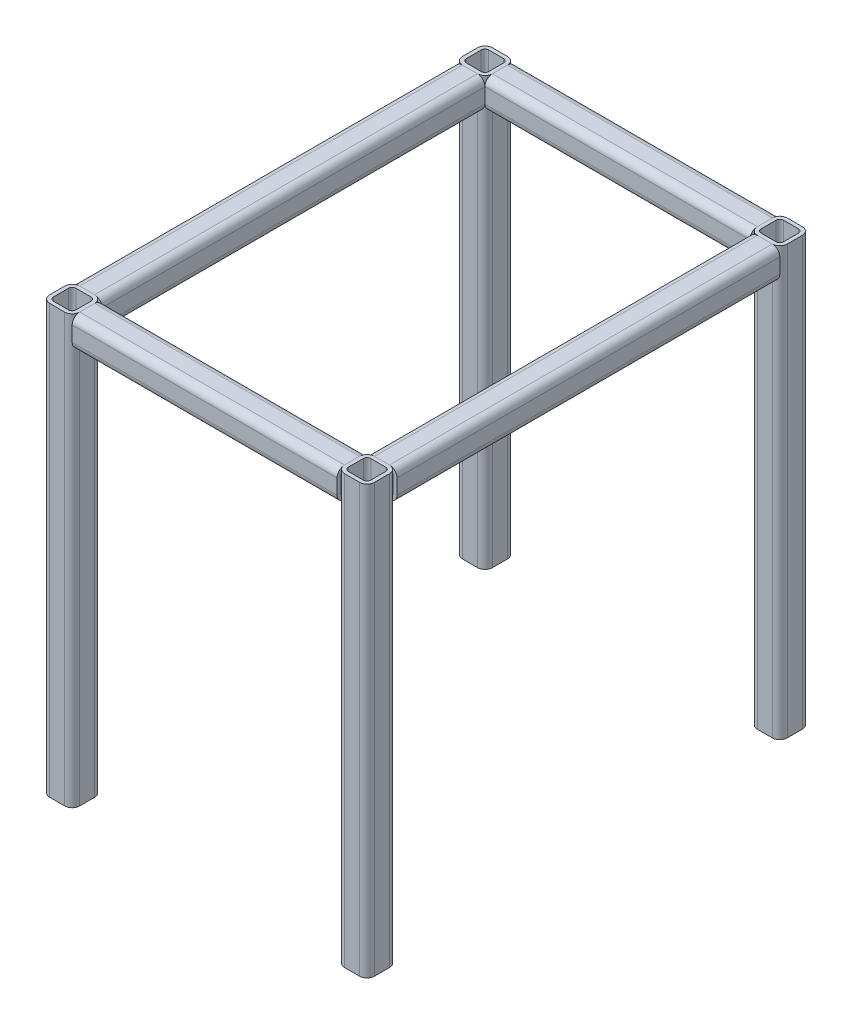
from build123d import *

# Parameters (mm, degrees)
SQUARE_TUBE_2_X_2_X_0_25_1_DEPTH      = 700
SQUARE_TUBE_2_X_2_X_0_25_1_DEPTH_BACK = 25.4
SQUARE_TUBE_2_X_2_X_0_25_1_2_DEPTH    = 725.4
SQUARE_TUBE_2_X_2_X_0_25_1_3_DEPTH    = 725.4
SQUARE_TUBE_2_X_2_X_0_25_1_4_DEPTH    = 725.4
SQUARE_TUBE_2_X_2_X_0_25_1_5_DEPTH    = 502
SQUARE_TUBE_2_X_2_X_0_25_1_6_DEPTH    = 502
SQUARE_TUBE_2_X_2_X_0_25_3_DEPTH      = 700
SQUARE_TUBE_2_X_2_X_0_25_3_2_DEPTH    = 700


with BuildPart() as part:
    # Sketch11 → Square tube 2 X 2 X 0.25(1) (new, two sides: drawn at the far end of the back side and taken through both)
    with BuildSketch(Plane(origin=(500, 0, 0), x_dir=(1, 0, 0), z_dir=(0, -1, 0)).offset(-SQUARE_TUBE_2_X_2_X_0_25_1_DEPTH_BACK)):
        with BuildLine():
            Line((-12.7, -25.4), (12.7, -25.4))
            ThreePointArc((12.7, -25.4), (21.680256121, -21.680256121), (25.4, -12.7))
            Line((25.4, -12.7), (25.4, 12.7))
            ThreePointArc((25.4, 12.7), (21.680256121, 21.680256121), (12.7, 25.4))
            Line((12.7, 25.4), (-12.7, 25.4))
            ThreePointArc((-12.7, 25.4), (-21.680256121, 21.680256121), (-25.4, 12.7))
            Line((-25.4, 12.7), (-25.4, -12.7))
            ThreePointArc((-25.4, -12.7), (-21.680256121, -21.680256121), (-12.7, -25.4))
        make_face()
        with BuildLine():
            Line((-12.7, -19.05), (12.7, -19.05))
            ThreePointArc((12.7, -19.05), (17.190128061, -17.190128061), (19.05, -12.7))
            Line((19.05, -12.7), (19.05, 12.7))
            ThreePointArc((19.05, 12.7), (17.190128061, 17.190128061), (12.7, 19.05))
            Line((12.7, 19.05), (-12.7, 19.05))
            ThreePointArc((-12.7, 19.05), (-17.190128061, 17.190128061), (-19.05, 12.7))
            Line((-19.05, 12.7), (-19.05, -12.7))
            ThreePointArc((-19.05, -12.7), (-17.190128061, -17.190128061), (-12.7, -19.05))
        make_face(mode=Mode.SUBTRACT)
    extrude(amount=SQUARE_TUBE_2_X_2_X_0_25_1_DEPTH + SQUARE_TUBE_2_X_2_X_0_25_1_DEPTH_BACK)


with BuildPart() as body_2:
    # Sketch11 on segment 2 (carried to segment 2) → Square tube 2 X 2 X 0.25_1 2 (new body)
    with BuildSketch(Plane.XZ.offset(-25.4)):
        with BuildLine():
            Line((-12.7, -25.4), (12.7, -25.4))
            ThreePointArc((12.7, -25.4), (21.680256121, -21.680256121), (25.4, -12.7))
            Line((25.4, -12.7), (25.4, 12.7))
            ThreePointArc((25.4, 12.7), (21.680256121, 21.680256121), (12.7, 25.4))
            Line((12.7, 25.4), (-12.7, 25.4))
            ThreePointArc((-12.7, 25.4), (-21.680256121, 21.680256121), (-25.4, 12.7))
            Line((-25.4, 12.7), (-25.4, -12.7))
            ThreePointArc((-25.4, -12.7), (-21.680256121, -21.680256121), (-12.7, -25.4))
        make_face()
        with BuildLine():
            Line((-12.7, -19.05), (12.7, -19.05))
            ThreePointArc((12.7, -19.05), (17.190128061, -17.190128061), (19.05, -12.7))
            Line((19.05, -12.7), (19.05, 12.7))
            ThreePointArc((19.05, 12.7), (17.190128061, 17.190128061), (12.7, 19.05))
            Line((12.7, 19.05), (-12.7, 19.05))
            ThreePointArc((-12.7, 19.05), (-17.190128061, 17.190128061), (-19.05, 12.7))
            Line((-19.05, 12.7), (-19.05, -12.7))
            ThreePointArc((-19.05, -12.7), (-17.190128061, -17.190128061), (-12.7, -19.05))
        make_face(mode=Mode.SUBTRACT)
    extrude(amount=SQUARE_TUBE_2_X_2_X_0_25_1_2_DEPTH)


with BuildPart() as body_3:
    # Sketch11 on segment 3 (carried to segment 3) → Square tube 2 X 2 X 0.25_1 3 (new body)
    with BuildSketch(Plane(origin=(500, 25.4, -700), x_dir=(1, 0, 0), z_dir=(0, -1, 0))):
        with BuildLine():
            Line((-12.7, -25.4), (12.7, -25.4))
            ThreePointArc((12.7, -25.4), (21.680256121, -21.680256121), (25.4, -12.7))
            Line((25.4, -12.7), (25.4, 12.7))
            ThreePointArc((25.4, 12.7), (21.680256121, 21.680256121), (12.7, 25.4))
            Line((12.7, 25.4), (-12.7, 25.4))
            ThreePointArc((-12.7, 25.4), (-21.680256121, 21.680256121), (-25.4, 12.7))
            Line((-25.4, 12.7), (-25.4, -12.7))
            ThreePointArc((-25.4, -12.7), (-21.680256121, -21.680256121), (-12.7, -25.4))
        make_face()
        with BuildLine():
            Line((-12.7, -19.05), (12.7, -19.05))
            ThreePointArc((12.7, -19.05), (17.190128061, -17.190128061), (19.05, -12.7))
            Line((19.05, -12.7), (19.05, 12.7))
            ThreePointArc((19.05, 12.7), (17.190128061, 17.190128061), (12.7, 19.05))
            Line((12.7, 19.05), (-12.7, 19.05))
            ThreePointArc((-12.7, 19.05), (-17.190128061, 17.190128061), (-19.05, 12.7))
            Line((-19.05, 12.7), (-19.05, -12.7))
            ThreePointArc((-19.05, -12.7), (-17.190128061, -17.190128061), (-12.7, -19.05))
        make_face(mode=Mode.SUBTRACT)
    extrude(amount=SQUARE_TUBE_2_X_2_X_0_25_1_3_DEPTH)


with BuildPart() as body_4:
    # Sketch11 on segment 4 (carried to segment 4) → Square tube 2 X 2 X 0.25_1 4 (new body)
    with BuildSketch(Plane(origin=(0, 25.4, -700), x_dir=(1, 0, 0), z_dir=(0, -1, 0))):
        with BuildLine():
            Line((-12.7, -25.4), (12.7, -25.4))
            ThreePointArc((12.7, -25.4), (21.680256121, -21.680256121), (25.4, -12.7))
            Line((25.4, -12.7), (25.4, 12.7))
            ThreePointArc((25.4, 12.7), (21.680256121, 21.680256121), (12.7, 25.4))
            Line((12.7, 25.4), (-12.7, 25.4))
            ThreePointArc((-12.7, 25.4), (-21.680256121, 21.680256121), (-25.4, 12.7))
            Line((-25.4, 12.7), (-25.4, -12.7))
            ThreePointArc((-25.4, -12.7), (-21.680256121, -21.680256121), (-12.7, -25.4))
        make_face()
        with BuildLine():
            Line((-12.7, -19.05), (12.7, -19.05))
            ThreePointArc((12.7, -19.05), (17.190128061, -17.190128061), (19.05, -12.7))
            Line((19.05, -12.7), (19.05, 12.7))
            ThreePointArc((19.05, 12.7), (17.190128061, 17.190128061), (12.7, 19.05))
            Line((12.7, 19.05), (-12.7, 19.05))
            ThreePointArc((-12.7, 19.05), (-17.190128061, 17.190128061), (-19.05, 12.7))
            Line((-19.05, 12.7), (-19.05, -12.7))
            ThreePointArc((-19.05, -12.7), (-17.190128061, -17.190128061), (-12.7, -19.05))
        make_face(mode=Mode.SUBTRACT)
    extrude(amount=SQUARE_TUBE_2_X_2_X_0_25_1_4_DEPTH)


with BuildPart() as body_5:
    # Sketch11 on segment 5 (carried to segment 5) → Square tube 2 X 2 X 0.25_1 5 (new body)
    with BuildSketch(Plane.YZ.offset(-1)):
        with BuildLine():
            Line((-12.7, -25.4), (12.7, -25.4))
            ThreePointArc((12.7, -25.4), (21.680256121, -21.680256121), (25.4, -12.7))
            Line((25.4, -12.7), (25.4, 12.7))
            ThreePointArc((25.4, 12.7), (21.680256121, 21.680256121), (12.7, 25.4))
            Line((12.7, 25.4), (-12.7, 25.4))
            ThreePointArc((-12.7, 25.4), (-21.680256121, 21.680256121), (-25.4, 12.7))
            Line((-25.4, 12.7), (-25.4, -12.7))
            ThreePointArc((-25.4, -12.7), (-21.680256121, -21.680256121), (-12.7, -25.4))
        make_face()
        with BuildLine():
            Line((-12.7, -19.05), (12.7, -19.05))
            ThreePointArc((12.7, -19.05), (17.190128061, -17.190128061), (19.05, -12.7))
            Line((19.05, -12.7), (19.05, 12.7))
            ThreePointArc((19.05, 12.7), (17.190128061, 17.190128061), (12.7, 19.05))
            Line((12.7, 19.05), (-12.7, 19.05))
            ThreePointArc((-12.7, 19.05), (-17.190128061, 17.190128061), (-19.05, 12.7))
            Line((-19.05, 12.7), (-19.05, -12.7))
            ThreePointArc((-19.05, -12.7), (-17.190128061, -17.190128061), (-12.7, -19.05))
        make_face(mode=Mode.SUBTRACT)
    extrude(amount=SQUARE_TUBE_2_X_2_X_0_25_1_5_DEPTH)

    # Square tube 2 X 2 X 0.25_1 5 end butt 1
    split(bisect_by=Plane.YZ.offset(25.4), keep=Keep.TOP)

    # Square tube 2 X 2 X 0.25_1 5 end butt 2
    split(bisect_by=Plane(origin=(474.6, 0, 0), x_dir=(0, -1, 0), z_dir=(-1, 0, 0)), keep=Keep.TOP)


with BuildPart() as body_6:
    # Sketch11 on segment 6 (carried to segment 6) → Square tube 2 X 2 X 0.25_1 6 (new body)
    with BuildSketch(Plane(origin=(-1, 0, -700), x_dir=(0, 1, 0), z_dir=(1, 0, 0))):
        with BuildLine():
            Line((-12.7, -25.4), (12.7, -25.4))
            ThreePointArc((12.7, -25.4), (21.680256121, -21.680256121), (25.4, -12.7))
            Line((25.4, -12.7), (25.4, 12.7))
            ThreePointArc((25.4, 12.7), (21.680256121, 21.680256121), (12.7, 25.4))
            Line((12.7, 25.4), (-12.7, 25.4))
            ThreePointArc((-12.7, 25.4), (-21.680256121, 21.680256121), (-25.4, 12.7))
            Line((-25.4, 12.7), (-25.4, -12.7))
            ThreePointArc((-25.4, -12.7), (-21.680256121, -21.680256121), (-12.7, -25.4))
        make_face()
        with BuildLine():
            Line((-12.7, -19.05), (12.7, -19.05))
            ThreePointArc((12.7, -19.05), (17.190128061, -17.190128061), (19.05, -12.7))
            Line((19.05, -12.7), (19.05, 12.7))
            ThreePointArc((19.05, 12.7), (17.190128061, 17.190128061), (12.7, 19.05))
            Line((12.7, 19.05), (-12.7, 19.05))
            ThreePointArc((-12.7, 19.05), (-17.190128061, 17.190128061), (-19.05, 12.7))
            Line((-19.05, 12.7), (-19.05, -12.7))
            ThreePointArc((-19.05, -12.7), (-17.190128061, -17.190128061), (-12.7, -19.05))
        make_face(mode=Mode.SUBTRACT)
    extrude(amount=SQUARE_TUBE_2_X_2_X_0_25_1_6_DEPTH)

    # Square tube 2 X 2 X 0.25_1 6 end butt 1
    split(bisect_by=Plane(origin=(25.4, 0, -700), x_dir=(0, 1, 0), z_dir=(1, 0, 0)), keep=Keep.TOP)

    # Square tube 2 X 2 X 0.25_1 6 end butt 2
    split(bisect_by=Plane(origin=(474.6, 0, -700), x_dir=(0, -1, 0), z_dir=(-1, 0, 0)), keep=Keep.TOP)


with BuildPart() as body_7:
    # Sketch1 → Square tube 2 X 2 X 0.25(3) (new body)
    with BuildSketch(Plane(origin=(500, 0, 0), x_dir=(1, 0, 0), z_dir=(0, 0, -1))):
        with BuildLine():
            Line((-12.7, -25.4), (12.7, -25.4))
            ThreePointArc((12.7, -25.4), (21.680256121, -21.680256121), (25.4, -12.7))
            Line((25.4, -12.7), (25.4, 12.7))
            ThreePointArc((25.4, 12.7), (21.680256121, 21.680256121), (12.7, 25.4))
            Line((12.7, 25.4), (-12.7, 25.4))
            ThreePointArc((-12.7, 25.4), (-21.680256121, 21.680256121), (-25.4, 12.7))
            Line((-25.4, 12.7), (-25.4, -12.7))
            ThreePointArc((-25.4, -12.7), (-21.680256121, -21.680256121), (-12.7, -25.4))
        make_face()
        with BuildLine():
            Line((-12.7, -19.05), (12.7, -19.05))
            ThreePointArc((12.7, -19.05), (17.190128061, -17.190128061), (19.05, -12.7))
            Line((19.05, -12.7), (19.05, 12.7))
            ThreePointArc((19.05, 12.7), (17.190128061, 17.190128061), (12.7, 19.05))
            Line((12.7, 19.05), (-12.7, 19.05))
            ThreePointArc((-12.7, 19.05), (-17.190128061, 17.190128061), (-19.05, 12.7))
            Line((-19.05, 12.7), (-19.05, -12.7))
            ThreePointArc((-19.05, -12.7), (-17.190128061, -17.190128061), (-12.7, -19.05))
        make_face(mode=Mode.SUBTRACT)
    extrude(amount=SQUARE_TUBE_2_X_2_X_0_25_3_DEPTH)

    # Trim/Extend1
    split(bisect_by=Plane(origin=(500, -337.3, -674.6), x_dir=(0, -1, 0), z_dir=(0, 0, 1)), keep=Keep.TOP)

    # Trim_Extend1 3
    split(bisect_by=Plane(origin=(500, -337.3, -25.4), x_dir=(0, 1, 0), z_dir=(0, 0, -1)), keep=Keep.TOP)


with BuildPart() as body_8:
    # Sketch1 on segment 2 (carried to segment 2) → Square tube 2 X 2 X 0.25_3 2 (new body)
    with BuildSketch(Plane(origin=(0, 0, 0), x_dir=(1, 0, 0), z_dir=(0, 0, -1))):
        with BuildLine():
            Line((-12.7, -25.4), (12.7, -25.4))
            ThreePointArc((12.7, -25.4), (21.680256121, -21.680256121), (25.4, -12.7))
            Line((25.4, -12.7), (25.4, 12.7))
            ThreePointArc((25.4, 12.7), (21.680256121, 21.680256121), (12.7, 25.4))
            Line((12.7, 25.4), (-12.7, 25.4))
            ThreePointArc((-12.7, 25.4), (-21.680256121, 21.680256121), (-25.4, 12.7))
            Line((-25.4, 12.7), (-25.4, -12.7))
            ThreePointArc((-25.4, -12.7), (-21.680256121, -21.680256121), (-12.7, -25.4))
        make_face()
        with BuildLine():
            Line((-12.7, -19.05), (12.7, -19.05))
            ThreePointArc((12.7, -19.05), (17.190128061, -17.190128061), (19.05, -12.7))
            Line((19.05, -12.7), (19.05, 12.7))
            ThreePointArc((19.05, 12.7), (17.190128061, 17.190128061), (12.7, 19.05))
            Line((12.7, 19.05), (-12.7, 19.05))
            ThreePointArc((-12.7, 19.05), (-17.190128061, 17.190128061), (-19.05, 12.7))
            Line((-19.05, 12.7), (-19.05, -12.7))
            ThreePointArc((-19.05, -12.7), (-17.190128061, -17.190128061), (-12.7, -19.05))
        make_face(mode=Mode.SUBTRACT)
    extrude(amount=SQUARE_TUBE_2_X_2_X_0_25_3_2_DEPTH)

    # Trim/Extend1
    split(bisect_by=Plane(origin=(500, -337.3, -674.6), x_dir=(0, -1, 0), z_dir=(0, 0, 1)), keep=Keep.TOP)

    # Trim_Extend1 3
    split(bisect_by=Plane(origin=(500, -337.3, -25.4), x_dir=(0, 1, 0), z_dir=(0, 0, -1)), keep=Keep.TOP)


solid = Compound([part.part, body_2.part, body_3.part, body_4.part, body_5.part, body_6.part, body_7.part, body_8.part])
